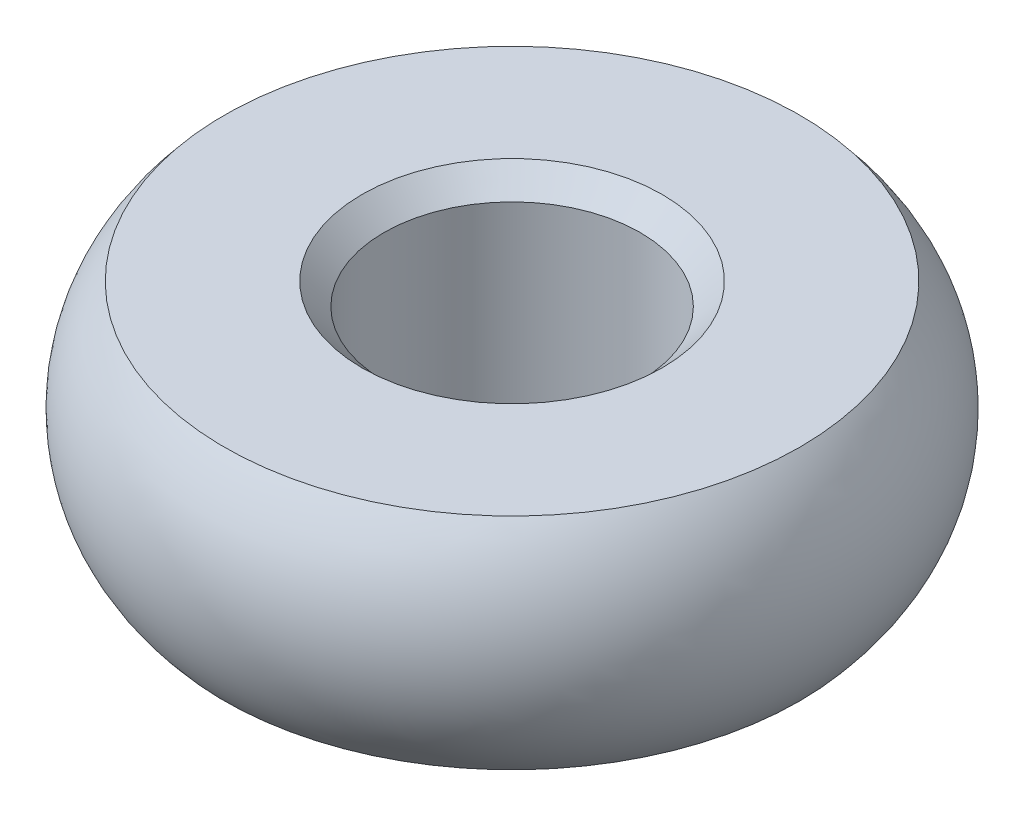
from build123d import *

# Parameters (mm, degrees)
CHAMFER1_SIZE = 3


with BuildPart() as part:
    # Sketch1 → Revolve1 (revolve)
    with BuildSketch(Plane.XY):
        with BuildLine():
            Line((39.270509831, 15), (17.5, 15))
            Line((17.5, 15), (17.5, -15))
            Line((17.5, -15), (39.270509831, -15))
            ThreePointArc((39.270509831, -15), (45, 0), (39.270509831, 15))
        make_face()
    revolve(axis=Axis((0, -794.376418342, 0), (0, 1, 0)))

    # Chamfer1
    chamfer1_edges = [part.edges().sort_by_distance(p)[0] for p in [
        (-17.5, 15, 0),
        (-17.5, -15, 0),
    ]]
    chamfer(chamfer1_edges, length=CHAMFER1_SIZE)


solid = part.part
